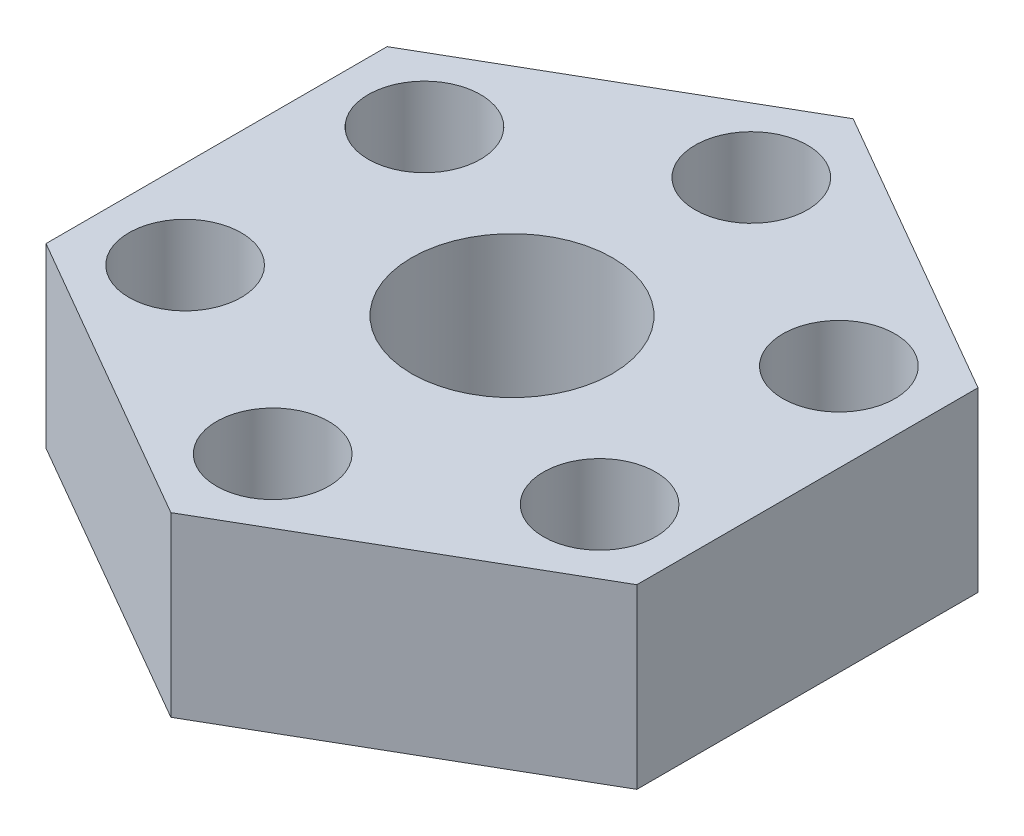
from build123d import *

# Parameters (mm, degrees)
SKETCH1_R           = 1.7
SKETCH1_R_2         = 0.95
BOSS_EXTRUDE1_DEPTH = 3


with BuildPart() as part:
    # Sketch1 → Boss-Extrude1 (new body)
    with BuildSketch(Plane(origin=(0, 0, 0), x_dir=(1, 0, 0), z_dir=(0, 1, 0))):
        Polygon((-5, -2.886751346), (0, -5.773502692), (5, -2.886751346), (5, 2.886751346), (0, 5.773502692), (-5, 2.886751346), align=None)
        with Locations(Location((0, 0, 0), (0, 0, 270))):
            Circle(SKETCH1_R, mode=Mode.SUBTRACT)
        with Locations(Location((-3.507402885, 2.025, 0), (0, 0, 270))):
            Circle(SKETCH1_R_2, mode=Mode.SUBTRACT)
        with Locations(Location((0, 4.05, 0), (0, 0, 270))):
            Circle(SKETCH1_R_2, mode=Mode.SUBTRACT)
        with Locations(Location((3.507402885, 2.025, 0), (0, 0, 270))):
            Circle(SKETCH1_R_2, mode=Mode.SUBTRACT)
        with Locations(Location((3.507402885, -2.025, 0), (0, 0, 270))):
            Circle(SKETCH1_R_2, mode=Mode.SUBTRACT)
        with Locations(Location((0, -4.05, 0), (0, 0, 270))):
            Circle(SKETCH1_R_2, mode=Mode.SUBTRACT)
        with Locations(Location((-3.507402885, -2.025, 0), (0, 0, 270))):
            Circle(SKETCH1_R_2, mode=Mode.SUBTRACT)
    extrude(amount=BOSS_EXTRUDE1_DEPTH)


solid = part.part
